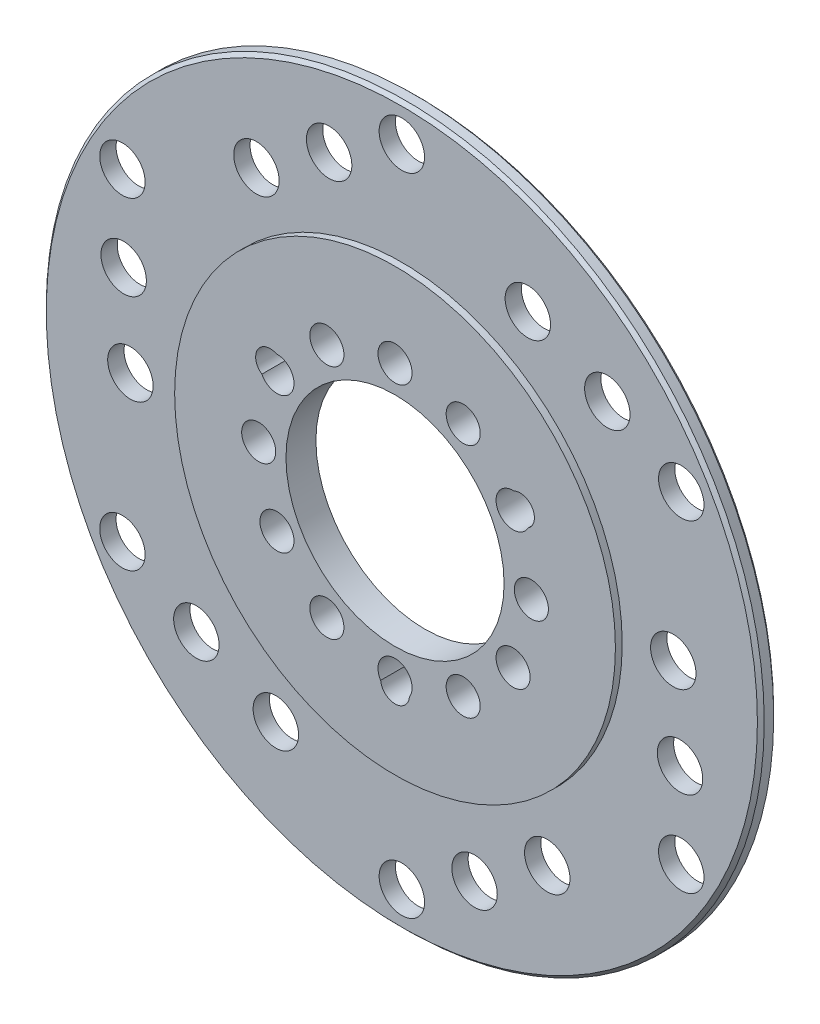
from build123d import *

# Parameters (mm, degrees)
SKETCH2_R                   = 79
SKETCH2_R_2                 = 24
BOSS_EXTRUDE1_DEPTH         = 3.59
BOSS_EXTRUDE2_DEPTH         = 1.5
BOSS_EXTRUDE2_DEPTH_BACK    = 5.09
SKETCH5_R                   = 48.5
SKETCH5_R_2                 = 24
CUT_EXTRUDE2_DEPTH          = 112.838759382
CUT_EXTRUDE2_DEPTH_BACK     = 112.838759382
SKETCH3_R                   = 3.75
SKETCH6_R                   = 5
CUT_EXTRUDE3_DEPTH          = 112.838759382
CHAMFER1_SIZE               = 0.75
F_1_4_0_25_DIAMETER_HOLE2_D = 6.35


with BuildPart() as part:
    # Sketch2 → Boss-Extrude1 (new body)
    with BuildSketch(Plane.XY):
        Circle(SKETCH2_R)
        Circle(SKETCH2_R_2, mode=Mode.SUBTRACT)
    extrude(amount=BOSS_EXTRUDE1_DEPTH)

    # Sketch5 → Boss-Extrude2 (add, two sides: drawn at the far end of the back side and taken through both)
    with BuildSketch(Plane.XY.offset(3.59).offset(-BOSS_EXTRUDE2_DEPTH_BACK)):
        Circle(SKETCH5_R)
        Circle(SKETCH5_R_2, mode=Mode.SUBTRACT)
    extrude(amount=BOSS_EXTRUDE2_DEPTH + BOSS_EXTRUDE2_DEPTH_BACK)

    # Sketch3 → Cut-Extrude2 (cut, two sides: drawn at the far end of the back side and taken through both)
    with BuildSketch(Plane.XY.offset(3.59).offset(-CUT_EXTRUDE2_DEPTH_BACK)):
        with Locations((0, -30)):
            Circle(SKETCH3_R)
        with Locations((-15, -25.980762114)):
            Circle(SKETCH3_R)
        with Locations((-25.980762114, -15)):
            Circle(SKETCH3_R)
        with Locations((-30, 0)):
            Circle(SKETCH3_R)
        with Locations((-25.980762114, 15)):
            Circle(SKETCH3_R)
        with Locations((-15, 25.980762114)):
            Circle(SKETCH3_R)
        with Locations((0, 30)):
            Circle(SKETCH3_R)
        with Locations((15, 25.980762114)):
            Circle(SKETCH3_R)
        with Locations((25.980762114, 15)):
            Circle(SKETCH3_R)
        with Locations((30, 0)):
            Circle(SKETCH3_R)
        with Locations((25.980762114, -15)):
            Circle(SKETCH3_R)
        with Locations((15, -25.980762114)):
            Circle(SKETCH3_R)
    extrude(amount=CUT_EXTRUDE2_DEPTH + CUT_EXTRUDE2_DEPTH_BACK, mode=Mode.SUBTRACT)

    # Sketch6 → Cut-Extrude3 (cut, through all)
    with BuildSketch(Plane.XY.offset(3.59)):
        with Locations((0, -71)):
            Circle(SKETCH6_R)
        with Locations((16, -61.451179551)):
            Circle(SKETCH6_R)
        with Locations((32, -50.494256022)):
            Circle(SKETCH6_R)
        with Locations((-61.487803669, -35.5)):
            Circle(SKETCH6_R)
        with Locations((-61.487803669, 35.5)):
            Circle(SKETCH6_R)
        with Locations((0, 71)):
            Circle(SKETCH6_R)
        with Locations((61.487803669, 35.5)):
            Circle(SKETCH6_R)
        with Locations((61.487803669, -35.5)):
            Circle(SKETCH6_R)
        with Locations((-45.218282583, -44.581996236)):
            Circle(SKETCH6_R)
        with Locations((-61.218282583, 16.869183315)):
            Circle(SKETCH6_R)
        with Locations((-16, 61.451179551)):
            Circle(SKETCH6_R)
        with Locations((45.218282583, 44.581996236)):
            Circle(SKETCH6_R)
        with Locations((61.218282583, -16.869183315)):
            Circle(SKETCH6_R)
        with Locations((-27.72930846, -52.959940932)):
            Circle(SKETCH6_R)
        with Locations((-59.72930846, -2.46568491)):
            Circle(SKETCH6_R)
        with Locations((-32, 50.494256022)):
            Circle(SKETCH6_R)
        with Locations((27.72930846, 52.959940932)):
            Circle(SKETCH6_R)
        with Locations((59.72930846, 2.46568491)):
            Circle(SKETCH6_R)
    extrude(amount=-CUT_EXTRUDE3_DEPTH, mode=Mode.SUBTRACT)

    # Chamfer1
    chamfer1_edges = [part.edges().sort_by_distance(p)[0] for p in [
        (-79, 0, 0),
        (-79, 0, 3.59),
    ]]
    chamfer(chamfer1_edges, length=CHAMFER1_SIZE)

    # 1/4 (0.25) Diameter Hole2 (through all)
    with Locations(Plane.XY.offset(5.09)):
        with Locations((27.49630657, 15.875), (0, -31.75), (-27.49630657, 15.875)):
            Hole(F_1_4_0_25_DIAMETER_HOLE2_D / 2)


solid = part.part
